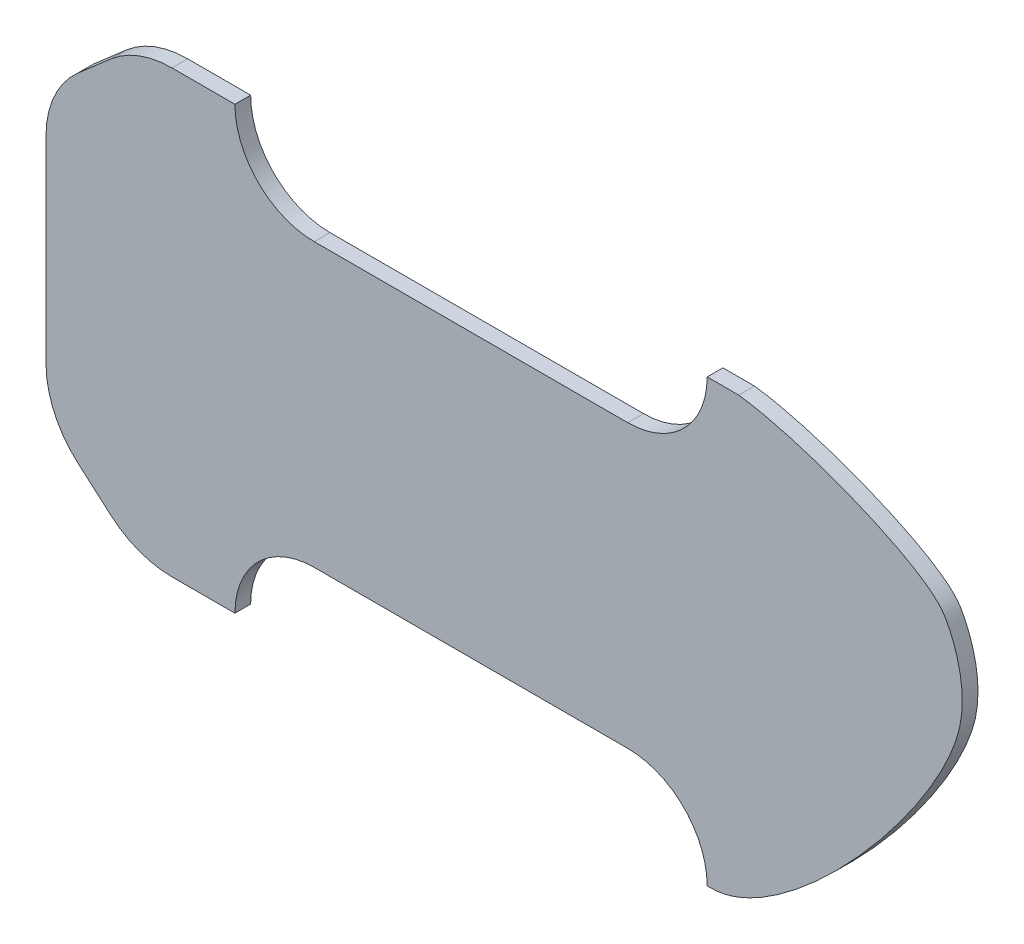
from build123d import *

# Parameters (mm, degrees)
BOSS_EXTRU_1_DEPTH = 5


with BuildPart() as part:
    # Esquisse1 → Boss.-Extru.1 (new body)
    with BuildSketch(Plane.XY):
        with BuildLine():
            Line((-77.472008168, 59.584338106), (-97.472008168, 59.584338106))
            ThreePointArc((-97.472008168, 59.584338106), (-107.866340849, 57.70059577), (-116.938550581, 52.288974233))
            Line((-116.938550581, 52.288974233), (-127.318550581, 43.23762235))
            ThreePointArc((-127.318550581, 43.23762235), (-134.813983205, 33.17575459), (-137.471408589, 20.913585802))
            Line((-137.471408589, 20.913585802), (-137.471408589, -41.746261473))
            ThreePointArc((-137.471408589, -41.746261473), (-134.813529559, -54.009427687), (-127.316898811, -64.071738255))
            Line((-127.316898811, -64.071738255), (-116.936898811, -73.121738255))
            ThreePointArc((-116.936898811, -73.121738255), (-107.865314786, -78.532304068), (-97.472008168, -80.415661894))
            Line((-97.472008168, -80.415661894), (-77.472008168, -80.415661894))
            ThreePointArc((-77.472008168, -80.415661894), (-70.091099054, -62.596571008), (-52.272008168, -55.215661894))
            Line((-52.272008168, -55.215661894), (47.327991832, -55.215661894))
            ThreePointArc((47.327991832, -55.215661894), (65.147082718, -62.596571008), (72.527991832, -80.415661894))
            Line((72.527991832, -80.415661894), (73.527991832, -80.415661894))
            add(Edge.make_bspline(
                [(82.527991832, 59.584338106), (101.294887559, 57.345225609), (142.468880392, 41.590471339), (150.722775832, 26.758890718), (154.234118929, 16.017198553), (151.364335726, -18.596789103), (97.275208729, -80.831964251), (73.527991832, -80.415661894)],
                knots=[0, 0, 0, 0, 0.313332962, 0.364624241, 0.496436288, 0.561621514, 1, 1, 1, 1], degree=3))
            Line((82.527991832, 59.584338106), (72.527991832, 59.584338106))
            ThreePointArc((72.527991832, 59.584338106), (65.147082718, 41.76524722), (47.327991832, 34.384338106))
            Line((47.327991832, 34.384338106), (-52.272008168, 34.384338106))
            ThreePointArc((-52.272008168, 34.384338106), (-70.091099054, 41.76524722), (-77.472008168, 59.584338106))
        make_face()
    extrude(amount=BOSS_EXTRU_1_DEPTH)


solid = part.part
